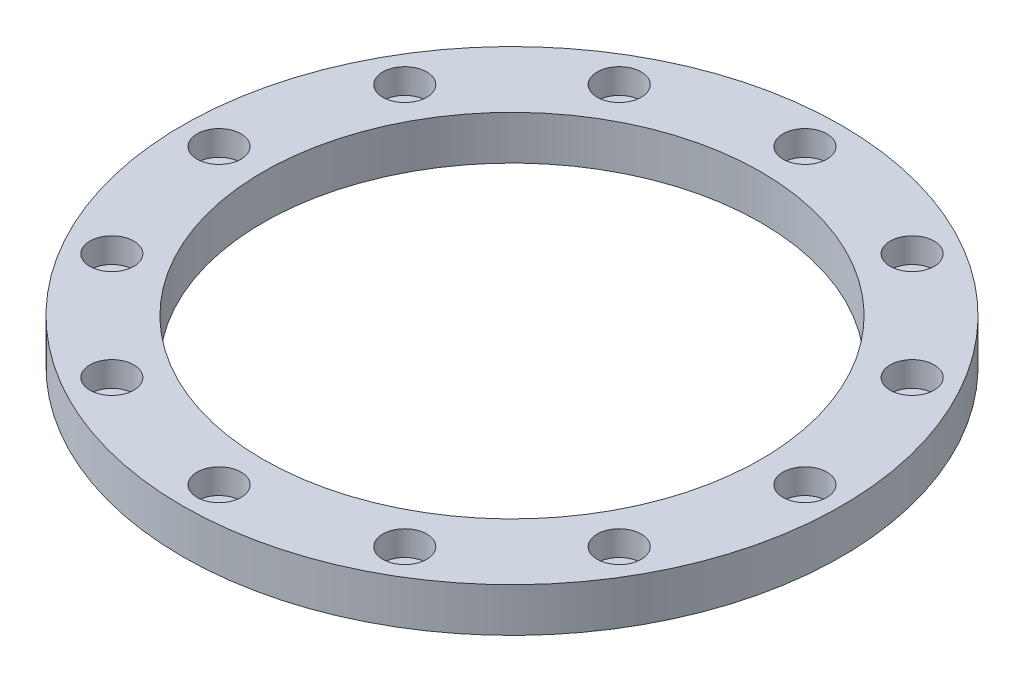
from build123d import *

# Parameters (mm, degrees)
SKETCH_1_R                = 45
SKETCH_1_R_2              = 34
EXTRUDE_1_DEPTH           = 6
HOLE_WIZARD_1_D           = 3.6
HOLE_WIZARD_1_CBORE_D     = 6
HOLE_WIZARD_1_CBORE_DEPTH = 3.4
PATTERN_CIRCULAR_1_COUNT  = 12


with BuildPart() as part:
    # 草图1 → 凸台-拉伸1 (new body)
    with BuildSketch(Plane(origin=(0, 0, 0), x_dir=(1, 0, 0), z_dir=(0, 1, 0))):
        Circle(SKETCH_1_R)
        Circle(SKETCH_1_R_2, mode=Mode.SUBTRACT)
    extrude(amount=EXTRUDE_1_DEPTH)

    # 打孔尺寸(%根据)内六角圆柱头螺钉的类型1 (through all)
    with Locations(Plane(origin=(0, 6, 0), x_dir=(1, 0, 0), z_dir=(0, 1, 0))):
        with Locations((0, 40)):
            hole_wizard_1 = CounterBoreHole(HOLE_WIZARD_1_D / 2, HOLE_WIZARD_1_CBORE_D / 2, HOLE_WIZARD_1_CBORE_DEPTH)

    # 阵列(圆周)1: 打孔尺寸(%根据)内六角圆柱头螺钉的类型1 ×12 about axis
    pattern_circular_1_axis = Axis((0, 6, 0), (0, -1, 0))
    for i in range(1, PATTERN_CIRCULAR_1_COUNT):
        add(hole_wizard_1.rotate(pattern_circular_1_axis, i * 360 / PATTERN_CIRCULAR_1_COUNT), mode=Mode.SUBTRACT)


solid = part.part
